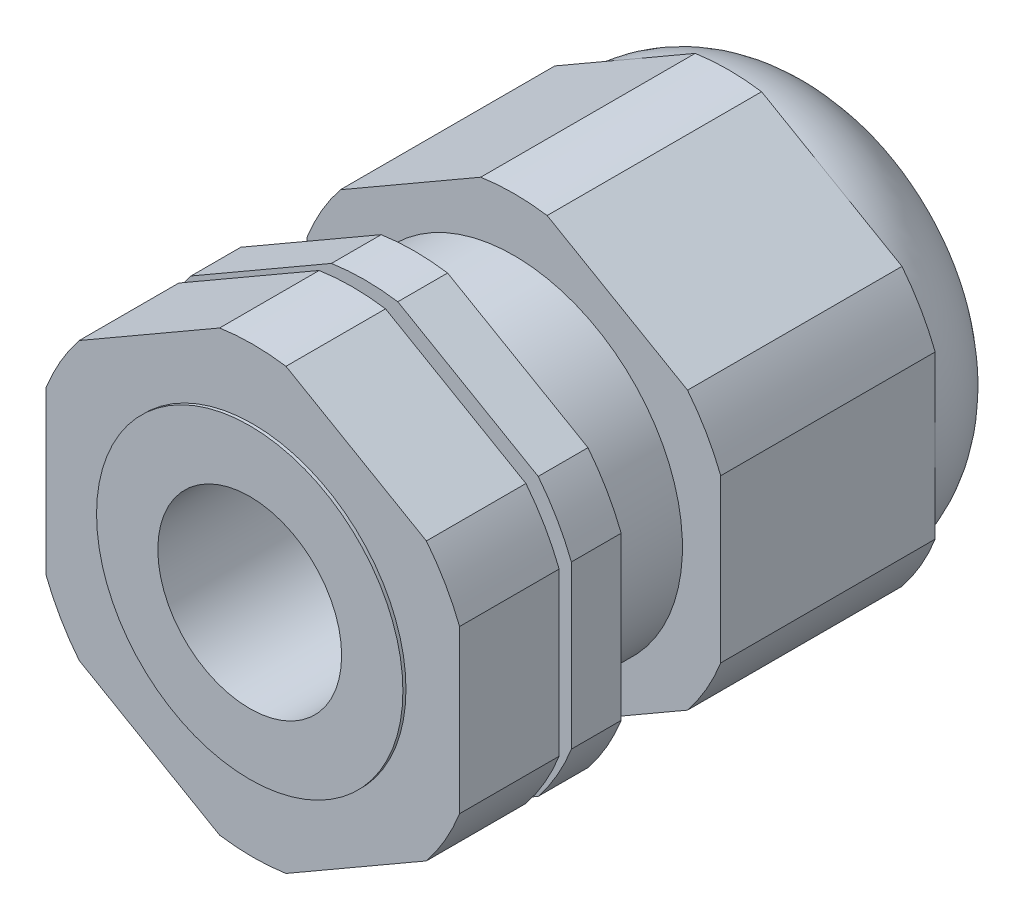
from build123d import *

# Parameters (mm, degrees)
SKETCH2_OUTSIDE_W  = 42.182
SKETCH2_OUTSIDE_H  = 42.182
CUT_EXTRUDE1_DEPTH = 44.003953307
SKETCH3_W          = 5
SKETCH3_H          = 6.5


with BuildPart() as part:
    # Sketch1 → Revolve1 (revolve)
    with BuildSketch(Plane(origin=(0, 0, 0), x_dir=(0, 0, -1), z_dir=(1, 0, 0)), mode=Mode.PRIVATE) as revolve1_sk:
        Polygon((-7.5, 10), (-7.3, 10), (-7.3, 14.5), (-0.8, 14.5), (-0.8, 10), (0, 10), (0, 14.5), (30.5, 14.5), (30.5, 6), (-7.5, 6), align=None)
    revolve(revolve1_sk.sketch.rotate(Axis((0, 0, 7.5), (0, 0, -1)), 90), axis=Axis((0, 0, 7.5), (0, 0, -1)))

    # Sketch2 outside → Cut-Extrude1 (cut, through all)
    with BuildSketch(Plane.XY.offset(7.3)):
        Rectangle(SKETCH2_OUTSIDE_W, SKETCH2_OUTSIDE_H)
        Polygon((0, 15.588457268), (-13.5, 7.794228634), (-13.5, -7.794228634), (0, -15.588457268), (13.5, -7.794228634), (13.5, 7.794228634), align=None, mode=Mode.SUBTRACT)
    extrude(amount=-CUT_EXTRUDE1_DEPTH, mode=Mode.SUBTRACT)

    # Sketch3 → Cut-Revolve3 (revolve, cut)
    with BuildSketch(Plane(origin=(0, 0, 0), x_dir=(1, 0, 0), z_dir=(0, 1, 0))):
        with BuildLine():
            Line((-6.75, 30.5), (-6.75, 35.5))
            Line((-6.75, 35.5), (-61.446878064, 35.5))
            Line((-61.446878064, 35.5), (-61.446878064, 23.75))
            Line((-61.446878064, 23.75), (-13.5, 23.75))
            ThreePointArc((-13.5, 23.75), (-11.522970773, 28.522970773), (-6.75, 30.5))
        make_face()
        with Locations((-13.5, 6.5)):
            Rectangle(SKETCH3_W, SKETCH3_H)
    revolve(axis=Axis((0, 0, -30.5), (0, 0, 1)), mode=Mode.SUBTRACT)


solid = part.part
